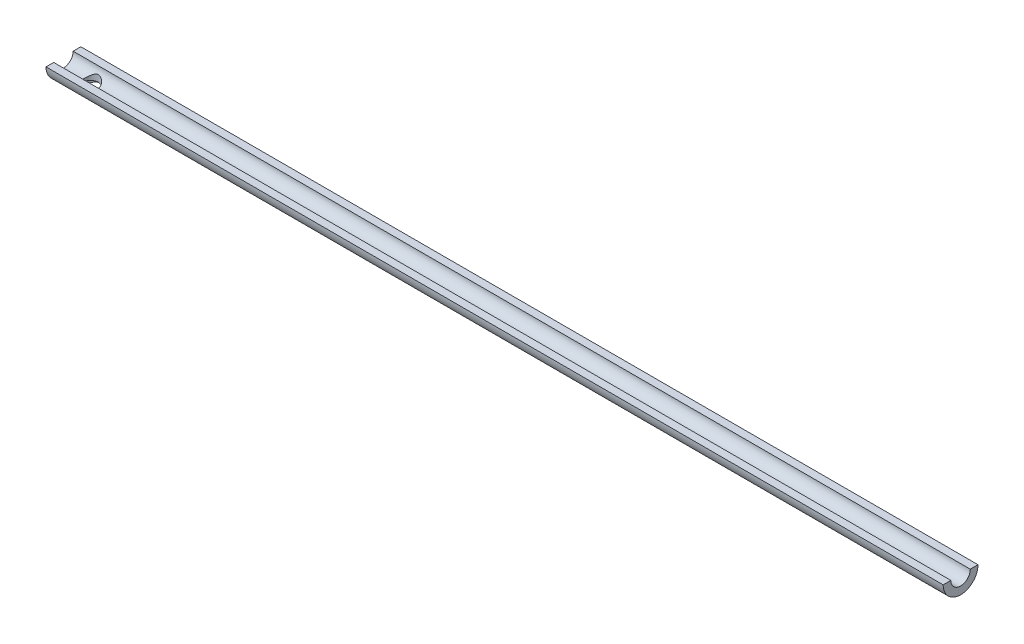
from build123d import *

# Parameters (mm, degrees)
SKETCH1_W                     = 735.584
SKETCH1_H                     = 38.1
WOOD_BLOCK_DEPTH              = 19.05
SKETCH2_R                     = 7.9756
INNER_BORE_DEPTH              = 737.816349952
SKETCH3_R                     = 6.3881
MOUTHPIECE_THROUGH_HOLE_DEPTH = 737.816349952
SKETCH5_R                     = 8.128
COUNTERBORE_DEPTH             = 8.89
SKETCH4_OUTSIDE_W             = 187.464
SKETCH4_OUTSIDE_H             = 168.414
SKETCH4_OUTSIDE_R             = 14.2875
OUTER_DIAMETER_DEPTH          = 737.816350054


with BuildPart() as part:
    # Sketch1 → wood block (new body)
    with BuildSketch(Plane(origin=(0, 0, 0), x_dir=(1, 0, 0), z_dir=(0, 1, 0))):
        with Locations((367.792, 19.05)):
            Rectangle(SKETCH1_W, SKETCH1_H)
    extrude(amount=WOOD_BLOCK_DEPTH)

    # Sketch2 → inner bore (cut, through all)
    with BuildSketch(Plane(origin=(735.584, 0, 0), x_dir=(0, 0, -1), z_dir=(1, 0, 0))):
        with Locations((19.05, 19.05)):
            Circle(SKETCH2_R)
    extrude(amount=-INNER_BORE_DEPTH, mode=Mode.SUBTRACT)

    # Sketch3 → mouthpiece through hole (cut, through all)
    with BuildSketch(Plane(origin=(0, 0, 0), x_dir=(1, 0, 0), z_dir=(0, 1, 0))):
        with Locations(Location((22.225, 19.05, 0), (0, 0, 90))):
            Circle(SKETCH3_R)
    extrude(amount=MOUTHPIECE_THROUGH_HOLE_DEPTH, mode=Mode.SUBTRACT)

    # Sketch5 → counterbore (cut)
    with BuildSketch(Plane.XZ):
        with Locations(Location((22.225, -19.05, 0), (0, 0, 270))):
            Circle(SKETCH5_R)
        with Locations(Location((713.359, -19.05, 0), (0, 0, 90))):
            Circle(SKETCH5_R)
    extrude(amount=-COUNTERBORE_DEPTH, mode=Mode.SUBTRACT)

    # Sketch4 outside → outer diameter (cut, through all)
    with BuildSketch(Plane.ZY):
        with Locations((-19.05, 9.525)):
            Rectangle(SKETCH4_OUTSIDE_W, SKETCH4_OUTSIDE_H)
        with Locations((-19.05, 19.05)):
            Circle(SKETCH4_OUTSIDE_R, mode=Mode.SUBTRACT)
    extrude(amount=-OUTER_DIAMETER_DEPTH, mode=Mode.SUBTRACT)


solid = part.part
